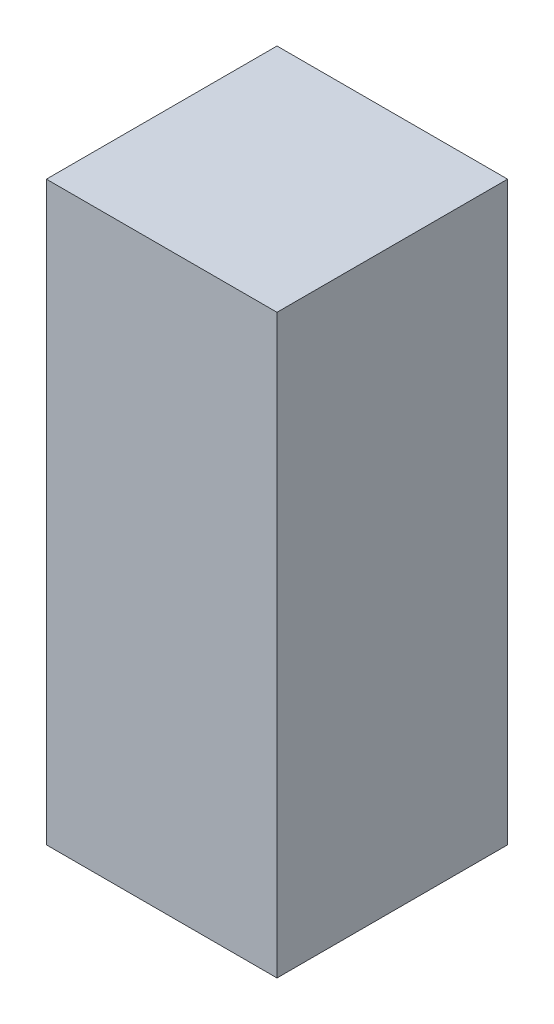
from build123d import *

# Parameters (mm, degrees)
SKETCH1_W           = 50.8
SKETCH1_H           = 50.8
BOSS_EXTRUDE1_DEPTH = 127


with BuildPart() as part:
    # Sketch1 → Boss-Extrude1 (new body)
    with BuildSketch(Plane(origin=(0, 0, 0), x_dir=(1, 0, 0), z_dir=(0, 1, 0))):
        with Locations((-4.625823518, -11.006973876)):
            Rectangle(SKETCH1_W, SKETCH1_H)
    extrude(amount=BOSS_EXTRUDE1_DEPTH)


solid = part.part
